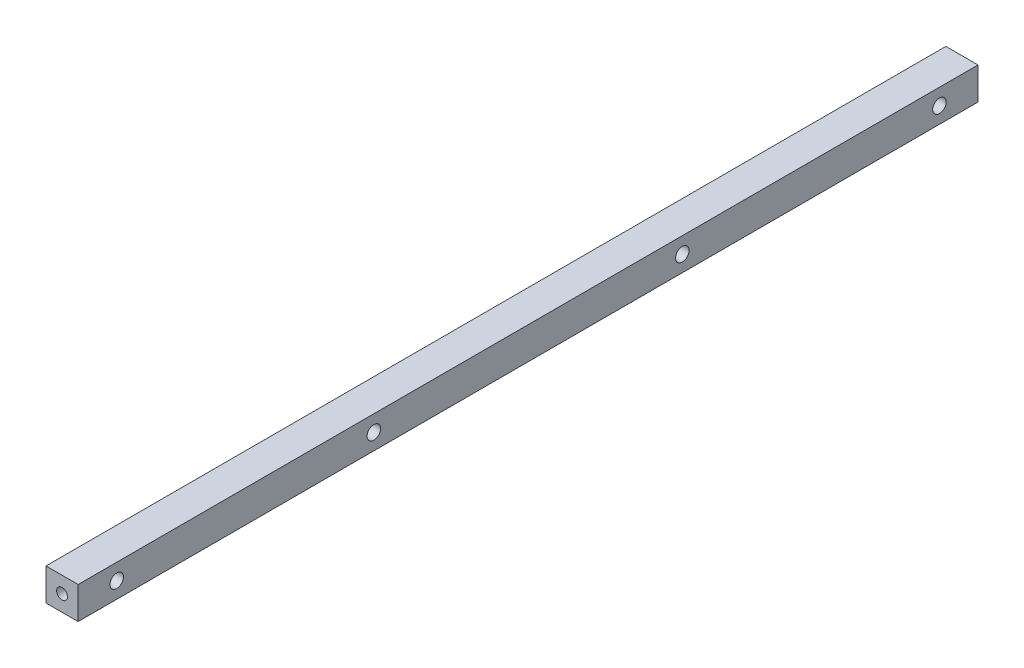
from build123d import *

# Parameters (mm, degrees)
SKETCH_1_W          = 25
SKETCH_1_H          = 25
EXTRUDE_1_DEPTH     = 700
SKETCH_2_W          = 3.2
SKETCH_2_H          = 10
CUT_EXTRUDE_1_DEPTH = 10
SKETCH_3_R          = 5.25
CUT_EXTRUDE_2_DEPTH = 701.892288444
SKETCH_4_R          = 4.25
CUT_EXTRUDE_3_DEPTH = 30
CUT_EXTRUDE_START   = -30
SKETCH_5_R          = 4.25
CUT_EXTRUDE_4_DEPTH = 30


with BuildPart() as part:
    # Эскиз1 → Бобышка-Вытянуть1 (new body)
    with BuildSketch(Plane.XY):
        with Locations((12.5, 12.5)):
            Rectangle(SKETCH_1_W, SKETCH_1_H)
    extrude(amount=EXTRUDE_1_DEPTH)

    # Эскиз2 → Вырез-Вытянуть1 (cut)
    with BuildSketch(Plane.ZY):
        with Locations((50, 5)):
            Rectangle(SKETCH_2_W, SKETCH_2_H)
        with Locations((100, 5)):
            Rectangle(SKETCH_2_W, SKETCH_2_H)
        with Locations((150, 5)):
            Rectangle(SKETCH_2_W, SKETCH_2_H)
        with Locations((200, 5)):
            Rectangle(SKETCH_2_W, SKETCH_2_H)
        with Locations((250, 5)):
            Rectangle(SKETCH_2_W, SKETCH_2_H)
        with Locations((300, 5)):
            Rectangle(SKETCH_2_W, SKETCH_2_H)
        with Locations((350, 5)):
            Rectangle(SKETCH_2_W, SKETCH_2_H)
        with Locations((400, 5)):
            Rectangle(SKETCH_2_W, SKETCH_2_H)
        with Locations((450, 5)):
            Rectangle(SKETCH_2_W, SKETCH_2_H)
        with Locations((500, 5)):
            Rectangle(SKETCH_2_W, SKETCH_2_H)
        with Locations((550, 5)):
            Rectangle(SKETCH_2_W, SKETCH_2_H)
        with Locations((600, 5)):
            Rectangle(SKETCH_2_W, SKETCH_2_H)
        with Locations((650, 5)):
            Rectangle(SKETCH_2_W, SKETCH_2_H)
    extrude(amount=-CUT_EXTRUDE_1_DEPTH, mode=Mode.SUBTRACT)

    # Эскиз3 → Вырез-Вытянуть2 (cut, through all)
    with BuildSketch(Plane.ZY):
        with Locations((30, 12.5)):
            Circle(SKETCH_3_R)
        with Locations((670, 12.5)):
            Circle(SKETCH_3_R)
        with Locations((230, 12.5)):
            Circle(SKETCH_3_R)
        with Locations((470, 12.5)):
            Circle(SKETCH_3_R)
    extrude(amount=-CUT_EXTRUDE_2_DEPTH, mode=Mode.SUBTRACT)

    # Эскиз4 → Вырез-Вытянуть3 (cut)
    with BuildSketch(Plane(origin=(0, 0, 0), x_dir=(-1, 0, 0), z_dir=(0, 0, -1))):
        with Locations((-12.5, 12.5)):
            Circle(SKETCH_4_R)
    extrude(amount=-CUT_EXTRUDE_3_DEPTH, mode=Mode.SUBTRACT)

    # Эскиз5 → Вырез-Вытянуть4 (cut)
    with BuildSketch(Plane.XY.offset(700).offset(CUT_EXTRUDE_START)):
        with Locations(Location((12.5, 12.5, 0), (0, 0, 180))):
            Circle(SKETCH_5_R)
    extrude(amount=CUT_EXTRUDE_4_DEPTH, mode=Mode.SUBTRACT)


solid = part.part
